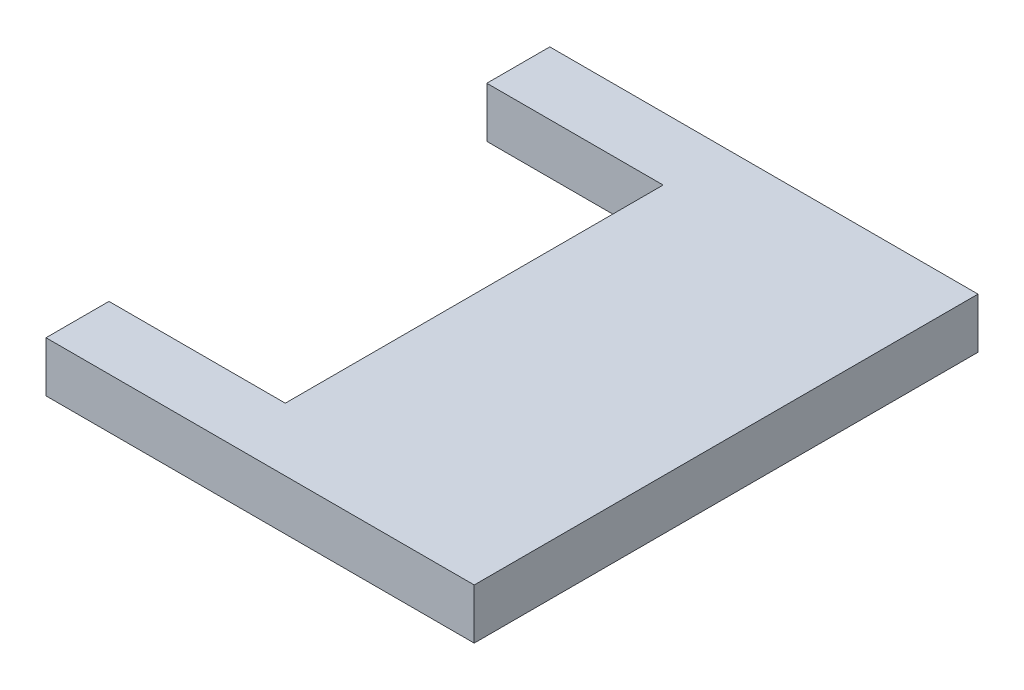
from build123d import *

# Parameters (mm, degrees)
SKETCH1_W           = 19
SKETCH1_H           = 20
SKETCH1_W_2         = 2
SKETCH1_H_2         = 5
BOSS_EXTRUDE1_DEPTH = 2
SKETCH2_W           = 5
SKETCH2_H           = 15
CUT_EXTRUDE1_DEPTH  = 10
CUT_EXTRUDE3_DEPTH  = 10


with BuildPart() as part:
    # Sketch1 → Boss-Extrude1 (new body)
    with BuildSketch(Plane(origin=(0, 0, 0), x_dir=(1, 0, 0), z_dir=(0, 1, 0))):
        with Locations((5.5, 0)):
            Rectangle(SKETCH1_W, SKETCH1_H)
        with Locations((-1, 5)):
            Rectangle(SKETCH1_W_2, SKETCH1_H_2, mode=Mode.SUBTRACT)
        with Locations((-1, -5)):
            Rectangle(SKETCH1_W_2, SKETCH1_H_2, mode=Mode.SUBTRACT)
    extrude(amount=BOSS_EXTRUDE1_DEPTH)

    # Sketch2 → Cut-Extrude1 (cut)
    with BuildSketch(Plane(origin=(0, 2, 0), x_dir=(1, 0, 0), z_dir=(0, 1, 0))):
        with Locations((2.5, 0)):
            Rectangle(SKETCH2_W, SKETCH2_H)
    extrude(amount=-CUT_EXTRUDE1_DEPTH, mode=Mode.SUBTRACT)

    # Sketch3 → Cut-Extrude3 (cut)
    with BuildSketch(Plane(origin=(0, 2, 0), x_dir=(1, 0, 0), z_dir=(0, 1, 0))):
        Polygon((-4, 10), (-2, 10), (-2, 3.892371719), (1.539535597, 3.892371719), (1.539535597, -3.189870508), (-2, -3.189870508), (-2, -10), (-4, -10), align=None)
    extrude(amount=-CUT_EXTRUDE3_DEPTH, mode=Mode.SUBTRACT)


solid = part.part
